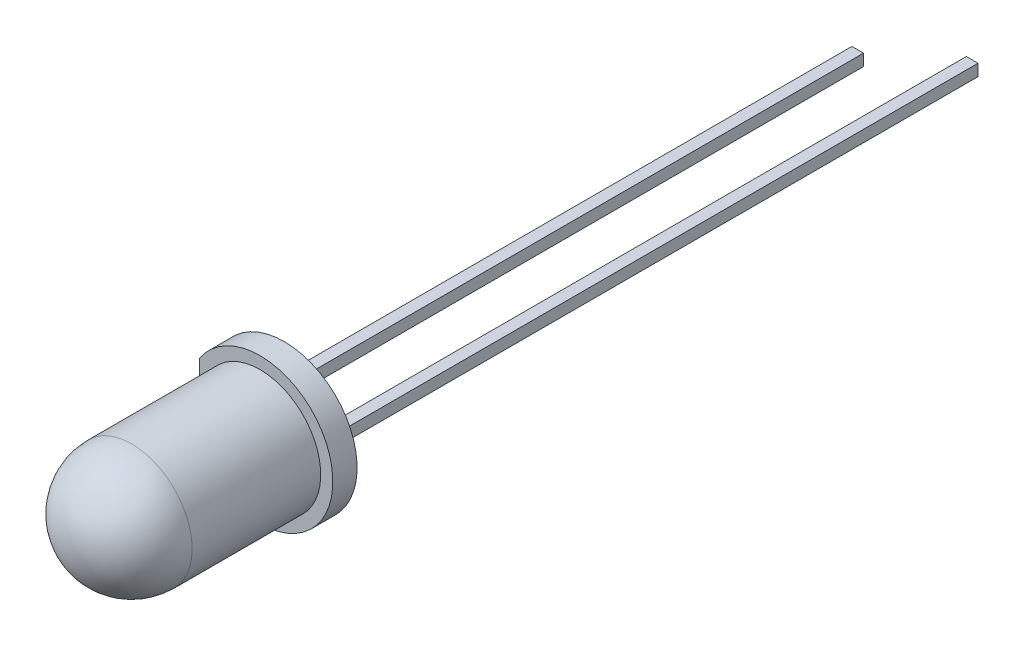
from build123d import *

# Parameters (mm, degrees)
ESBO_O1_R                  = 3
RESSALTO_EXTRUS_O1_DEPTH   = 1
CORTE_EXTRUS_O1_DEPTH      = 1
ESBO_O5_W                  = 0.48
ESBO_O5_H                  = 0.48
RESSALTO_EXTRUS_O2_DEPTH   = 25
RESSALTO_EXTRUS_O2_2_DEPTH = 25
ESBO_O6_W                  = 0.48
ESBO_O6_H                  = 0.48
RESSALTO_EXTRUS_O3_DEPTH   = 2
CORTE_EXTRUS_O2_DEPTH      = 0.24
RESSALTO_EXTRUS_O4_DEPTH   = 0.24
RESSALTO_EXTRUS_O4_2_DEPTH = 0.24
ESBO_O12_R                 = 0.2
CORTE_EXTRUS_O3_DEPTH      = 0.1


with BuildPart() as part:
    # Esboço1 → Ressalto-extrusão1 (new body)
    with BuildSketch(Plane.XY):
        Circle(ESBO_O1_R)
    extrude(amount=RESSALTO_EXTRUS_O1_DEPTH)

    # Esboço3 → Revolução1 (revolve)
    with BuildSketch(Plane(origin=(0, 0, 0), x_dir=(0, 0, -1), z_dir=(1, 0, 0))):
        with BuildLine():
            Line((-1, 0), (-8.8, 0))
            ThreePointArc((-8.8, 0), (-8.067766953, 1.767766953), (-6.3, 2.5))
            Line((-6.3, 2.5), (-1, 2.5))
            Line((-1, 2.5), (-1, 0))
        make_face()
    revolve(axis=Axis((0, 0, 1), (0, 0, 1)))

    # Esboço4 → Corte-extrusão1 (cut)
    with BuildSketch(Plane(origin=(0, 0, 0), x_dir=(-1, 0, 0), z_dir=(0, 0, -1))):
        with BuildLine():
            Line((2.5, 1.658312395), (2.5, -1.658312395))
            ThreePointArc((2.5, -1.658312395), (3, 0), (2.5, 1.658312395))
        make_face()
    extrude(amount=-CORTE_EXTRUS_O1_DEPTH, mode=Mode.SUBTRACT)

    # Esboço7 → Corte-extrusão2 (cut, symmetric)
    with BuildSketch(Plane(origin=(0, 0, 0), x_dir=(1, 0, 0), z_dir=(0, 1, 0))):
        Polygon((-1.6, 0), (-1.6, -3.5), (-1.3, -4), (1.2, -4), (0.02, -2), (-1.12, -2), (-1.12, 0), align=None)
        Polygon((1.6, 0), (1.6, -4), (1.4, -4), (0.22, -2), (1.12, -2), (1.12, 0), align=None)
    extrude(amount=CORTE_EXTRUS_O2_DEPTH, both=True, mode=Mode.SUBTRACT)


with BuildPart() as body_2:
    # Esboço5 → Ressalto-extrusão2 (new body)
    with BuildSketch(Plane(origin=(0, 0, 0), x_dir=(-1, 0, 0), z_dir=(0, 0, -1))):
        with Locations((-1.36, 0)):
            Rectangle(ESBO_O5_W, ESBO_O5_H)
    extrude(amount=RESSALTO_EXTRUS_O2_DEPTH)


with BuildPart() as body_3:
    # Esboço5 → Ressalto-extrus_o2 2 (new body)
    with BuildSketch(Plane(origin=(0, 0, 0), x_dir=(-1, 0, 0), z_dir=(0, 0, -1))):
        with Locations((1.36, 0)):
            Rectangle(ESBO_O5_W, ESBO_O5_H)
    extrude(amount=RESSALTO_EXTRUS_O2_2_DEPTH)


with BuildPart() as body_4:
    # Esboço6 → Ressalto-extrusão3 (new body)
    with BuildSketch(Plane(origin=(0, 0, -25), x_dir=(-1, 0, 0), z_dir=(0, 0, -1))):
        with Locations((-1.36, 0)):
            Rectangle(ESBO_O6_W, ESBO_O6_H)
    extrude(amount=RESSALTO_EXTRUS_O3_DEPTH)


with BuildPart() as body_5:
    # Esboço8 → Ressalto-extrusão4 (new, symmetric)
    with BuildSketch(Plane(origin=(0, 0, 0), x_dir=(1, 0, 0), z_dir=(0, 1, 0))):
        Polygon((-1.3, -4), (1.2, -4), (0.02, -2), (-1.12, -2), (-1.12, 0), (-1.6, 0), (-1.6, -3.5), align=None)
    extrude(amount=RESSALTO_EXTRUS_O4_DEPTH, both=True)

    # Combinar2: union body 3
    add(body_3.part)

    # Esboço10 → Corte-Revolução1 (revolve, cut)
    with BuildSketch(Plane(origin=(0, 0, 0), x_dir=(1, 0, 0), z_dir=(0, 1, 0))):
        with BuildLine():
            Line((-0.05, -4), (-0.05, -3.7))
            ThreePointArc((-0.05, -3.7), (-0.341547595, -3.780754009), (-0.55, -4))
            Line((-0.55, -4), (-0.05, -4))
        make_face()
    revolve(axis=Axis((-0.05, 0, 4), (0, 0, -1)), mode=Mode.SUBTRACT)


with BuildPart() as body_6:
    # Esboço8 → Ressalto-extrus_o4 2 (new, symmetric)
    with BuildSketch(Plane(origin=(0, 0, 0), x_dir=(1, 0, 0), z_dir=(0, 1, 0))):
        Polygon((0.22, -2), (1.4, -4), (1.6, -4), (1.6, 0), (1.12, 0), (1.12, -2), align=None)
    extrude(amount=RESSALTO_EXTRUS_O4_2_DEPTH, both=True)

    # Combinar1: union body 4, body 2
    add(body_4.part)
    add(body_2.part)


with BuildPart() as body_4_2:
    # Esboço11 → Revolução2 (revolve)
    with BuildSketch(Plane(origin=(0, 0, 0), x_dir=(1, 0, 0), z_dir=(0, 1, 0))):
        with BuildLine():
            Line((-0.55, -4), (-0.05, -4))
            Line((-0.05, -4), (-0.05, -3.7))
            ThreePointArc((-0.05, -3.7), (-0.341547595, -3.780754009), (-0.55, -4))
        make_face()
    revolve(axis=Axis((-0.05, 0, 4), (0, 0, -1)))

    # Combinar3: union body 5
    add(body_5.part)

    # Esboço12 → Corte-extrusão3 (cut)
    with BuildSketch(Plane.XY.offset(4)):
        with Locations((-0.05, 0)):
            Circle(ESBO_O12_R)
    extrude(amount=-CORTE_EXTRUS_O3_DEPTH, mode=Mode.SUBTRACT)


solid = Compound([part.part, body_6.part, body_4_2.part])
